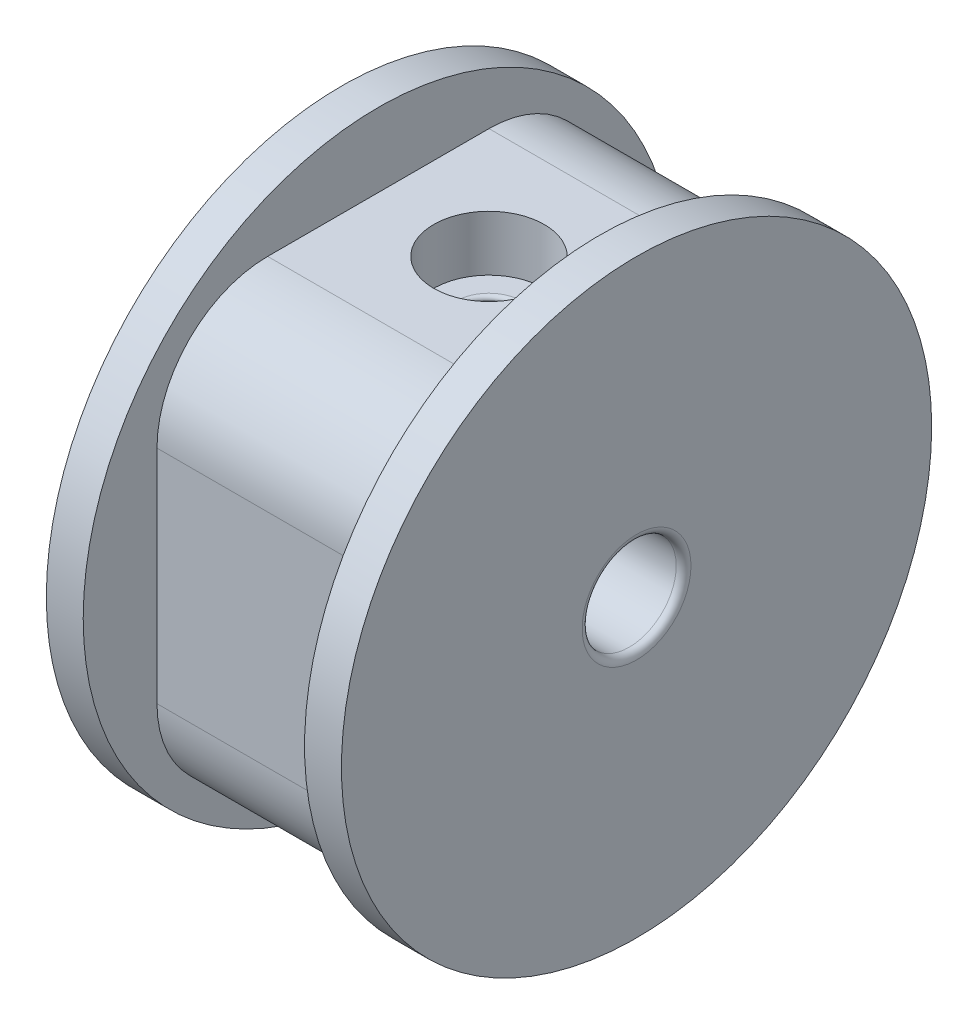
from build123d import *

# Parameters (mm, degrees)
SKETCH_1_W          = 24
SKETCH_1_H          = 24
EXTRUDE_1_DEPTH     = 12
FILLET_1_R          = 6
SKETCH_3_R          = 1.6
CUT_EXTRUDE_1_DEPTH = 9
SKETCH_4_R          = 3
CUT_EXTRUDE_2_DEPTH = 3
SKETCH_5_R          = 1.55
CUT_EXTRUDE_3_DEPTH = 23
SKETCH_7_R          = 16
EXTRUDE_2_DEPTH     = 2
EXTRUDE_START       = 2
SKETCH_8_R          = 16
EXTRUDE_3_DEPTH     = 2
SKETCH_9_R          = 2.55
CUT_EXTRUDE_4_DEPTH = 22
FILLET_2_R          = 0.2
FILLET_3_R          = 0.4


with BuildPart() as part:
    # 草图1 → 凸台-拉伸1 (new body)
    with BuildSketch(Plane(origin=(0, 0, 0), x_dir=(0, 0, -1), z_dir=(1, 0, 0))):
        with Locations((-12, 12)):
            Rectangle(SKETCH_1_W, SKETCH_1_H)
    extrude(amount=EXTRUDE_1_DEPTH)

    # 圆角1
    fillet_1_edges = [part.edges().sort_by_distance(p)[0] for p in [
        (6, 0, 0),
        (6, 0, 24),
        (6, 24, 24),
        (6, 24, 0),
    ]]
    fillet(fillet_1_edges, radius=FILLET_1_R)

    # 草图3 → 切除-拉伸1 (cut)
    with BuildSketch(Plane(origin=(0, 24, 0), x_dir=(1, 0, 0), z_dir=(0, 1, 0))):
        with Locations(Location((6, -12, 0), (0, 0, 270))):
            Circle(SKETCH_3_R)
    extrude(amount=-CUT_EXTRUDE_1_DEPTH, mode=Mode.SUBTRACT)

    # 草图4 → 切除-拉伸2 (cut)
    with BuildSketch(Plane(origin=(0, 24, 0), x_dir=(1, 0, 0), z_dir=(0, 1, 0))):
        with Locations(Location((6, -12, 0), (0, 0, 270))):
            Circle(SKETCH_4_R)
    extrude(amount=-CUT_EXTRUDE_2_DEPTH, mode=Mode.SUBTRACT)

    # 草图5 → 切除-拉伸3 (cut)
    with BuildSketch(Plane.ZY):
        with Locations((12, 12)):
            Circle(SKETCH_5_R)
    extrude(amount=-CUT_EXTRUDE_3_DEPTH, mode=Mode.SUBTRACT)

    # 草图7 → 凸台-拉伸2 (add)
    with BuildSketch(Plane(origin=(12, 0, 0), x_dir=(0, 0, -1), z_dir=(1, 0, 0))):
        with Locations((-12, 12)):
            Circle(SKETCH_7_R)
    extrude(amount=EXTRUDE_2_DEPTH)

    # 草图8 → 凸台-拉伸3 (add)
    with BuildSketch(Plane.ZY.offset(EXTRUDE_START)):
        with Locations(Location((12, 12, 0), (0, 0, 180))):
            Circle(SKETCH_8_R)
    extrude(amount=-EXTRUDE_3_DEPTH)

    # 草图9 → 切除-拉伸4 (cut)
    with BuildSketch(Plane.ZY.offset(2)):
        with Locations((12, 12)):
            Circle(SKETCH_9_R)
    extrude(amount=-CUT_EXTRUDE_4_DEPTH, mode=Mode.SUBTRACT)

    # 圆角2
    fillet_2_edges = [part.edges().sort_by_distance(p)[0] for p in [
        (6, 21, 10.4),
    ]]
    fillet(fillet_2_edges, radius=FILLET_2_R)

    # 圆角3
    fillet_3_edges = [part.edges().sort_by_distance(p)[0] for p in [
        (14, 12, 9.45),
        (-2, 12, 9.45),
    ]]
    fillet(fillet_3_edges, radius=FILLET_3_R)


solid = part.part
